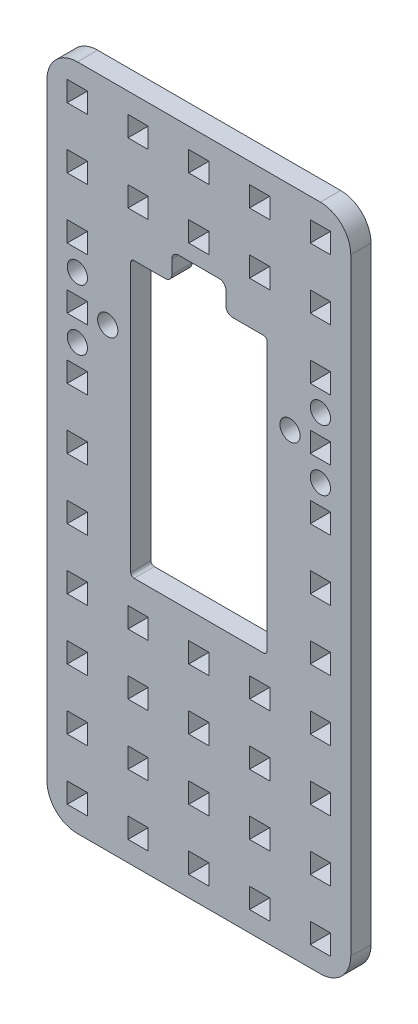
from build123d import *

# Parameters (mm, degrees)
MODEL_R                 = 1.5
MODEL_W                 = 3
MODEL_H                 = 3
SALIENTE_EXTRUIR1_DEPTH = 3


with BuildPart() as part:
    # Model → Saliente-Extruir1 (new body)
    with BuildSketch(Plane.XY):
        with BuildLine():
            Line((13.608524471, 199.498543913), (49.608524471, 199.498543913))
            ThreePointArc((49.608524471, 199.498543913), (52.790504986, 200.816563398), (54.108524471, 203.998543913))
            Line((54.108524471, 203.998543913), (54.108524471, 293.998543913))
            ThreePointArc((54.108524471, 293.998543913), (52.790504986, 297.180524429), (49.608524471, 298.498543913))
            Line((49.608524471, 298.498543913), (13.608524471, 298.498543913))
            ThreePointArc((13.608524471, 298.498543913), (10.426543955, 297.180524429), (9.108524471, 293.998543913))
            Line((9.108524471, 293.998543913), (9.108524471, 203.998543913))
            ThreePointArc((9.108524471, 203.998543913), (10.426543955, 200.816563398), (13.608524471, 199.498543913))
        make_face()
        with Locations((45.108524471, 266.998543913)):
            Circle(MODEL_R, mode=Mode.SUBTRACT)
        with Locations((18.108524471, 266.998543913)):
            Circle(MODEL_R, mode=Mode.SUBTRACT)
        with Locations((49.608524471, 262.498543913)):
            Circle(MODEL_R, mode=Mode.SUBTRACT)
        with Locations((49.608524471, 271.498543913)):
            Circle(MODEL_R, mode=Mode.SUBTRACT)
        with Locations((13.608524471, 262.498543913)):
            Circle(MODEL_R, mode=Mode.SUBTRACT)
        with Locations((13.608524471, 271.498543913)):
            Circle(MODEL_R, mode=Mode.SUBTRACT)
        with Locations((49.608524471, 293.998543913)):
            Rectangle(MODEL_W, MODEL_H, mode=Mode.SUBTRACT)
        with Locations((49.608524471, 284.998543913)):
            Rectangle(MODEL_W, MODEL_H, mode=Mode.SUBTRACT)
        with Locations((49.608524471, 275.998543913)):
            Rectangle(MODEL_W, MODEL_H, mode=Mode.SUBTRACT)
        with Locations((49.608524471, 266.998543913)):
            Rectangle(MODEL_W, MODEL_H, mode=Mode.SUBTRACT)
        with Locations((49.608524471, 257.998543913)):
            Rectangle(MODEL_W, MODEL_H, mode=Mode.SUBTRACT)
        with Locations((49.608524471, 248.998543913)):
            Rectangle(MODEL_W, MODEL_H, mode=Mode.SUBTRACT)
        with Locations((49.608524471, 239.998543913)):
            Rectangle(MODEL_W, MODEL_H, mode=Mode.SUBTRACT)
        with Locations((49.608524471, 230.998543913)):
            Rectangle(MODEL_W, MODEL_H, mode=Mode.SUBTRACT)
        with Locations((49.608524471, 221.998543913)):
            Rectangle(MODEL_W, MODEL_H, mode=Mode.SUBTRACT)
        with Locations((49.608524471, 212.998543913)):
            Rectangle(MODEL_W, MODEL_H, mode=Mode.SUBTRACT)
        with Locations((49.608524471, 203.998543913)):
            Rectangle(MODEL_W, MODEL_H, mode=Mode.SUBTRACT)
        with Locations((13.608524471, 293.998543913)):
            Rectangle(MODEL_W, MODEL_H, mode=Mode.SUBTRACT)
        with Locations((13.608524471, 284.998543913)):
            Rectangle(MODEL_W, MODEL_H, mode=Mode.SUBTRACT)
        with Locations((13.608524471, 275.998543913)):
            Rectangle(MODEL_W, MODEL_H, mode=Mode.SUBTRACT)
        with Locations((13.608524471, 266.998543913)):
            Rectangle(MODEL_W, MODEL_H, mode=Mode.SUBTRACT)
        with Locations((13.608524471, 257.998543913)):
            Rectangle(MODEL_W, MODEL_H, mode=Mode.SUBTRACT)
        with Locations((13.608524471, 248.998543913)):
            Rectangle(MODEL_W, MODEL_H, mode=Mode.SUBTRACT)
        with Locations((13.608524471, 239.998543913)):
            Rectangle(MODEL_W, MODEL_H, mode=Mode.SUBTRACT)
        with Locations((13.608524471, 230.998543913)):
            Rectangle(MODEL_W, MODEL_H, mode=Mode.SUBTRACT)
        with Locations((13.608524471, 221.998543913)):
            Rectangle(MODEL_W, MODEL_H, mode=Mode.SUBTRACT)
        with Locations((13.608524471, 212.998543913)):
            Rectangle(MODEL_W, MODEL_H, mode=Mode.SUBTRACT)
        with Locations((13.608524471, 203.998543913)):
            Rectangle(MODEL_W, MODEL_H, mode=Mode.SUBTRACT)
        with Locations((40.608524471, 203.998543913)):
            Rectangle(MODEL_W, MODEL_H, mode=Mode.SUBTRACT)
        with Locations((22.608524471, 203.998543913)):
            Rectangle(MODEL_W, MODEL_H, mode=Mode.SUBTRACT)
        with Locations((31.608524471, 203.998543913)):
            Rectangle(MODEL_W, MODEL_H, mode=Mode.SUBTRACT)
        with Locations((40.608524471, 221.998543913)):
            Rectangle(MODEL_W, MODEL_H, mode=Mode.SUBTRACT)
        with Locations((22.608524471, 221.998543913)):
            Rectangle(MODEL_W, MODEL_H, mode=Mode.SUBTRACT)
        with Locations((31.608524471, 221.998543913)):
            Rectangle(MODEL_W, MODEL_H, mode=Mode.SUBTRACT)
        with Locations((40.608524471, 212.998543913)):
            Rectangle(MODEL_W, MODEL_H, mode=Mode.SUBTRACT)
        with Locations((22.608524471, 212.998543913)):
            Rectangle(MODEL_W, MODEL_H, mode=Mode.SUBTRACT)
        with Locations((31.608524471, 212.998543913)):
            Rectangle(MODEL_W, MODEL_H, mode=Mode.SUBTRACT)
        with Locations((40.608524471, 293.998543913)):
            Rectangle(MODEL_W, MODEL_H, mode=Mode.SUBTRACT)
        with Locations((22.608524471, 293.998543913)):
            Rectangle(MODEL_W, MODEL_H, mode=Mode.SUBTRACT)
        with Locations((31.608524471, 293.998543913)):
            Rectangle(MODEL_W, MODEL_H, mode=Mode.SUBTRACT)
        with Locations((40.608524471, 284.998543913)):
            Rectangle(MODEL_W, MODEL_H, mode=Mode.SUBTRACT)
        with Locations((22.608524471, 284.998543913)):
            Rectangle(MODEL_W, MODEL_H, mode=Mode.SUBTRACT)
        with Locations((40.608524471, 230.998543913)):
            Rectangle(MODEL_W, MODEL_H, mode=Mode.SUBTRACT)
        with Locations((22.608524471, 230.998543913)):
            Rectangle(MODEL_W, MODEL_H, mode=Mode.SUBTRACT)
        with Locations((31.608524471, 230.998543913)):
            Rectangle(MODEL_W, MODEL_H, mode=Mode.SUBTRACT)
        with Locations((31.608524471, 284.998543913)):
            Rectangle(MODEL_W, MODEL_H, mode=Mode.SUBTRACT)
        with BuildLine():
            Line((21.508214184, 276.698579599), (21.508214184, 236.948579599))
            ThreePointArc((21.508214184, 236.948579599), (21.654660793, 236.595026209), (22.008214184, 236.448579599))
            Line((22.008214184, 236.448579599), (41.208214184, 236.448579599))
            ThreePointArc((41.208214184, 236.448579599), (41.561767574, 236.595026209), (41.708214184, 236.948579599))
            Line((41.708214184, 236.948579599), (41.708214184, 276.698579599))
            ThreePointArc((41.708214184, 276.698579599), (41.561767574, 277.05213299), (41.208214184, 277.198579599))
            Line((41.208214184, 277.198579599), (36.608214184, 277.198579599))
            ThreePointArc((36.608214184, 277.198579599), (35.901107403, 277.491472818), (35.608214184, 278.198579599))
            Line((35.608214184, 278.198579599), (35.608214184, 280.198579599))
            ThreePointArc((35.608214184, 280.198579599), (35.315320965, 280.905686381), (34.608214184, 281.198579599))
            Line((34.608214184, 281.198579599), (28.608214184, 281.198579599))
            ThreePointArc((28.608214184, 281.198579599), (27.901107403, 280.905686381), (27.608214184, 280.198579599))
            Line((27.608214184, 280.198579599), (27.608214184, 278.198579599))
            ThreePointArc((27.608214184, 278.198579599), (27.315320965, 277.491472818), (26.608214184, 277.198579599))
            Line((26.608214184, 277.198579599), (22.008214184, 277.198579599))
            ThreePointArc((22.008214184, 277.198579599), (21.654660793, 277.05213299), (21.508214184, 276.698579599))
        make_face(mode=Mode.SUBTRACT)
    extrude(amount=SALIENTE_EXTRUIR1_DEPTH)


solid = part.part
